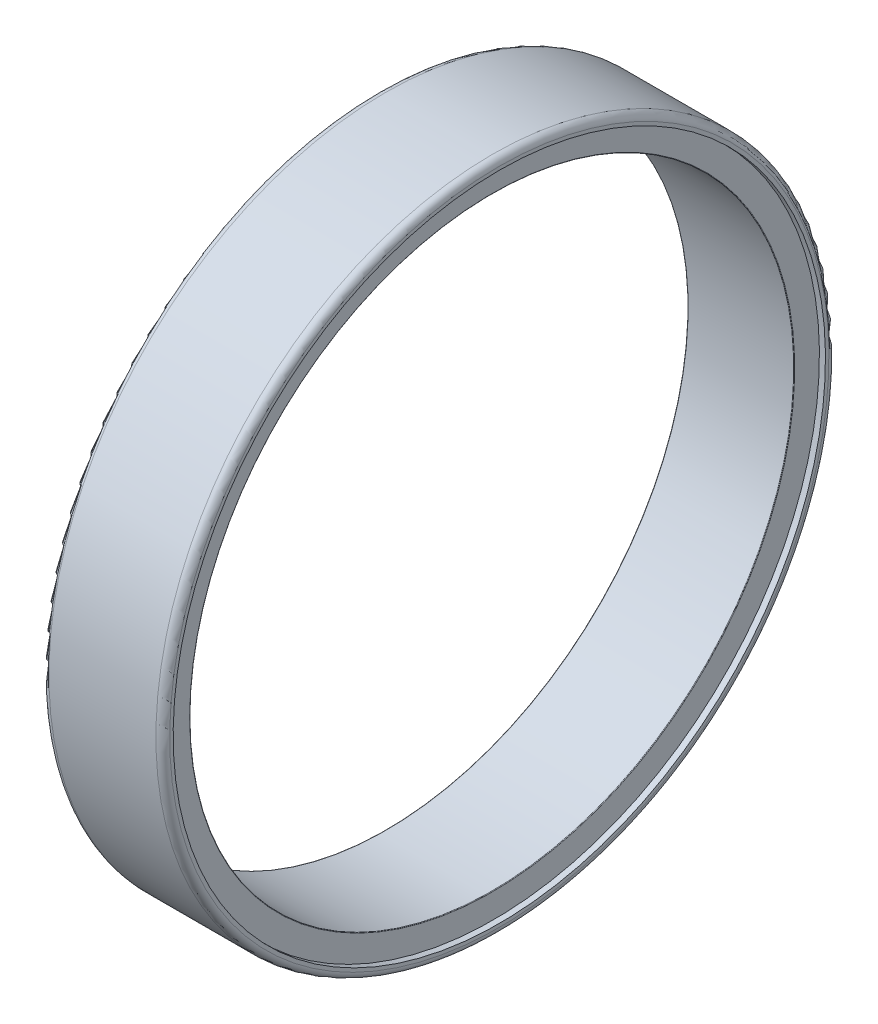
from build123d import *


with BuildPart() as part:
    # InnRacSke → Race (revolve)
    with BuildSketch(Plane.XY):
        with BuildLine():
            Line((-6.3, 37.8), (-7, 37.8))
            Line((-7, 37.8), (-7, 38.2))
            ThreePointArc((-7, 38.2), (-6.765685425, 38.765685425), (-6.2, 39))
            Line((-6.2, 39), (6.2, 39))
            ThreePointArc((6.2, 39), (6.765685425, 38.765685425), (7, 38.2))
            Line((7, 38.2), (7, 37.8))
            Line((7, 37.8), (6.3, 37.8))
            Line((6.3, 37.8), (6.3, 38.2))
            Line((6.3, 38.2), (-6.3, 38.2))
            Line((-6.3, 38.2), (-6.3, 37.8))
        make_face()
    revolve(axis=Axis((-31.75, 0, 0), (1, 0, 0)))

    # RolSimSke → RollersSimplified (revolve)
    with BuildSketch(Plane.XY):
        with BuildLine():
            Line((-6.10998, 38.201), (6.10998, 38.201))
            ThreePointArc((6.10998, 38.201), (6.155248976, 38.182248976), (6.174, 38.13698))
            Line((6.174, 38.13698), (6.174, 35.06402))
            ThreePointArc((6.174, 35.06402), (6.155248976, 35.018751024), (6.10998, 35))
            Line((6.10998, 35), (-6.10998, 35))
            ThreePointArc((-6.10998, 35), (-6.155248976, 35.018751024), (-6.174, 35.06402))
            Line((-6.174, 35.06402), (-6.174, 38.13698))
            ThreePointArc((-6.174, 38.13698), (-6.155248976, 38.182248976), (-6.10998, 38.201))
        make_face()
    revolve(axis=Axis((-25.4, 0, 0), (1, 0, 0)))


solid = part.part
